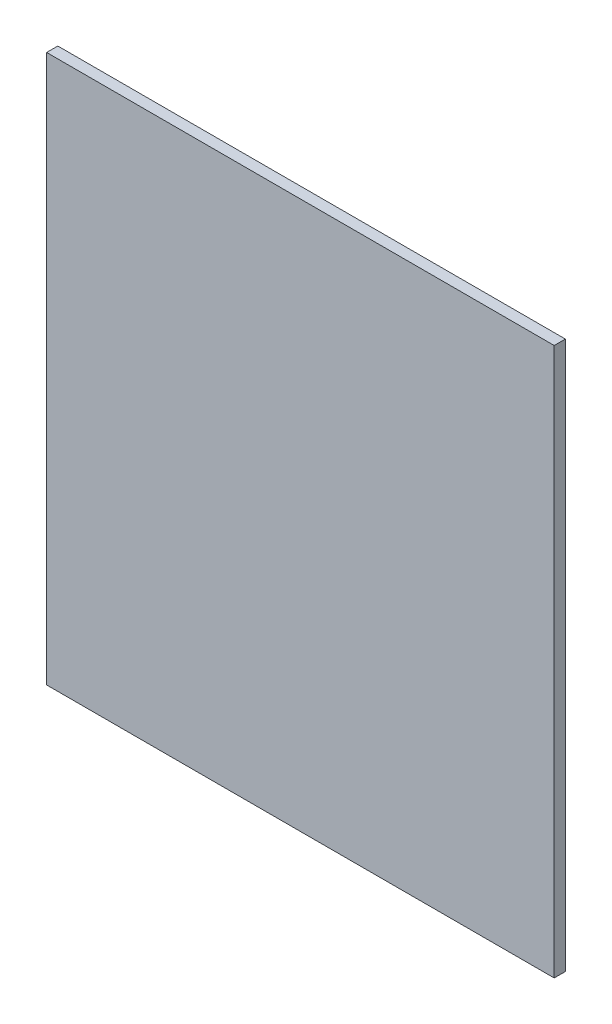
from build123d import *

# Parameters (mm, degrees)
SKETCH1_W           = 56.8
SKETCH1_H           = 61.3
BOSS_EXTRUDE1_DEPTH = 1.25


with BuildPart() as part:
    # Sketch1 → Boss-Extrude1 (new body)
    with BuildSketch(Plane.XY):
        with Locations((5.4, 7.65)):
            Rectangle(SKETCH1_W, SKETCH1_H)
    extrude(amount=BOSS_EXTRUDE1_DEPTH)


solid = part.part
